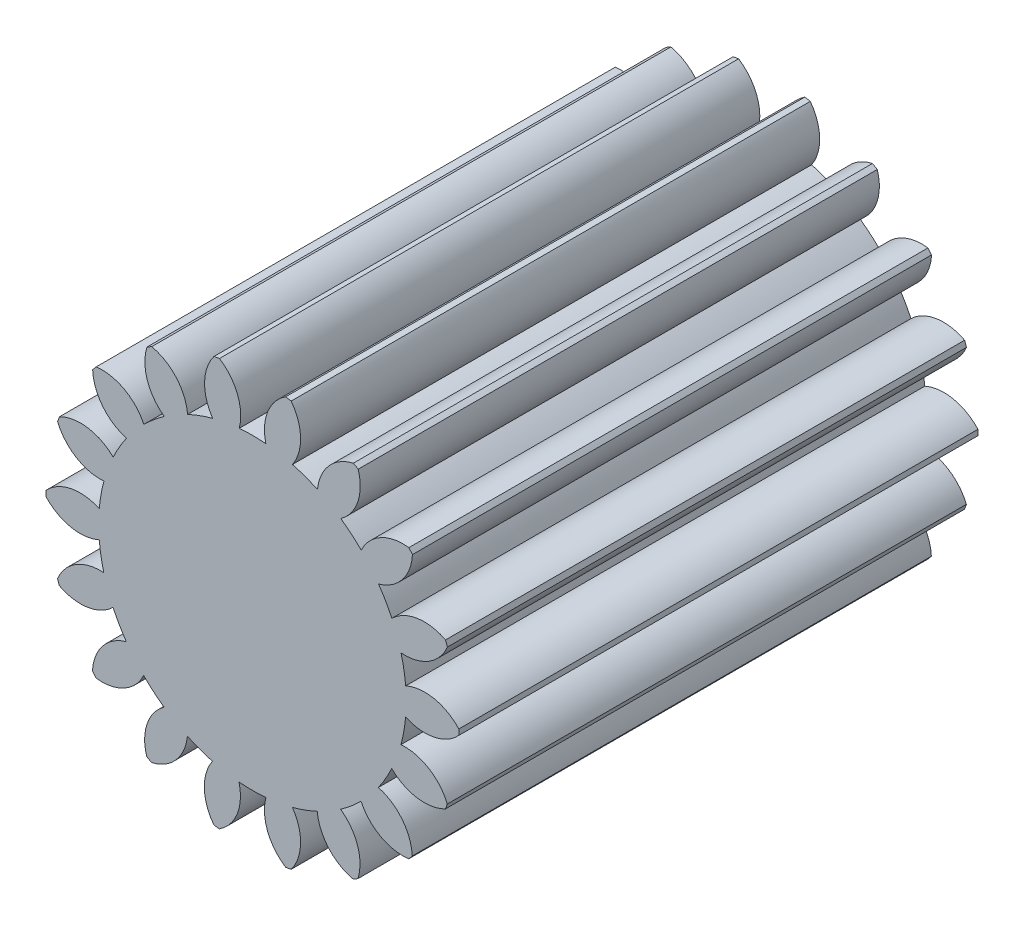
from build123d import *

# Parameters (mm, degrees)
BOSS_EXTRUDE1_DEPTH = 50


with BuildPart() as part:
    # Sketch4 → Boss-Extrude1 (new body)
    with BuildSketch(Plane.XY):
        with BuildLine():
            ThreePointArc((4.968986099, 0.120803098), (5.101132242, 0.098182628), (5.233497909, 0.076884301))
            ThreePointArc((5.233497909, 0.076884301), (6.972697635, 2.203383358), (7.139946857, 4.945433981))
            ThreePointArc((7.139946857, 4.945433981), (8.434999235, 4.888713692), (9.730051613, 4.945433981))
            ThreePointArc((9.730051613, 4.945433981), (9.897300835, 2.203383358), (11.636500561, 0.076884301))
            ThreePointArc((11.636500561, 0.076884301), (11.768866228, 0.098182628), (11.901012371, 0.120803098))
            ThreePointArc((11.901012371, 0.120803098), (12.032925783, 0.144743452), (12.16459328, 0.170001296))
            ThreePointArc((12.16459328, 0.170001296), (13.0716304, 2.764324962), (12.289539875, 5.399010148))
            ThreePointArc((12.289539875, 5.399010148), (13.501291083, 5.782037637), (14.675751687, 6.26752022))
            ThreePointArc((14.675751687, 6.26752022), (15.77017858, 3.746516175), (18.132608433, 2.342181169))
            ThreePointArc((18.132608433, 2.342181169), (18.366147116, 2.473919706), (18.597005377, 2.61030087))
            ThreePointArc((18.597005377, 2.61030087), (18.562422416, 5.35722969), (16.927986588, 7.56526806))
            ThreePointArc((16.927986588, 7.56526806), (17.946753802, 8.346079322), (18.894100505, 9.212155005))
            ThreePointArc((18.894100505, 9.212155005), (20.784759544, 7.217502149), (23.485028304, 6.705857505))
            ThreePointArc((23.485028304, 6.705857505), (23.659425648, 6.909526169), (23.829716347, 7.116640718))
            ThreePointArc((23.829716347, 7.116640718), (22.857714006, 9.686081391), (20.566653119, 11.201948778))
            ThreePointArc((20.566653119, 11.201948778), (21.256927973, 12.284110268), (21.850927349, 13.421966851))
            ThreePointArc((21.850927349, 13.421966851), (24.309777153, 12.194249757), (27.022192556, 12.637007368))
            ThreePointArc((27.022192556, 12.637007368), (27.116413667, 12.888040714), (27.205597232, 13.140907576))
            ThreePointArc((27.205597232, 13.140907576), (25.413413337, 15.222947636), (22.742063147, 15.863808061))
            ThreePointArc((22.742063147, 15.863808061), (23.020588306, 17.116795131), (23.189595265, 18.389190318))
            ThreePointArc((23.189595265, 18.389190318), (25.920062258, 18.076489787), (28.317466974, 19.420246552))
            ThreePointArc((28.317466974, 19.420246552), (28.320147397, 19.688366252), (28.317466974, 19.956485953))
            ThreePointArc((28.317466974, 19.956485953), (25.921265354, 21.30000064), (23.191830118, 20.988556878))
            ThreePointArc((23.191830118, 20.988556878), (23.025011337, 22.261240797), (22.748641145, 23.514704949))
            ThreePointArc((22.748641145, 23.514704949), (25.42139071, 24.154737279), (27.21462235, 26.2374163))
            ThreePointArc((27.21462235, 26.2374163), (27.125438785, 26.490283162), (27.031217673, 26.741316508))
            ThreePointArc((27.031217673, 26.741316508), (24.320015606, 27.184258124), (21.861705497, 25.958074888))
            ThreePointArc((21.861705497, 25.958074888), (21.269663582, 27.096951192), (20.581250564, 28.180298033))
            ThreePointArc((20.581250564, 28.180298033), (22.873909658, 29.695865881), (23.84667802, 32.26626533))
            ThreePointArc((23.84667802, 32.26626533), (23.676387321, 32.473379879), (23.501989977, 32.677048544))
            ThreePointArc((23.501989977, 32.677048544), (20.802798446, 32.165991792), (18.912121943, 30.172964878))
            ThreePointArc((18.912121943, 30.172964878), (17.966265888, 31.040668276), (16.948842813, 31.82323019))
            ThreePointArc((16.948842813, 31.82323019), (18.584882913, 34.031533704), (18.619857777, 36.779625474))
            ThreePointArc((18.619857777, 36.779625474), (18.388999516, 36.916006638), (18.155460833, 37.047745174))
            ThreePointArc((18.155460833, 37.047745174), (15.793842173, 35.644331042), (14.698842765, 33.124848909))
            ThreePointArc((14.698842765, 33.124848909), (13.51325677, 33.616721566), (12.289539875, 34.004110035))
            ThreePointArc((12.289539875, 34.004110035), (13.0716304, 36.638795221), (12.16459328, 39.233118887))
            ThreePointArc((12.16459328, 39.233118887), (11.901012371, 39.282317085), (11.636500561, 39.326235881))
            ThreePointArc((11.636500561, 39.326235881), (9.897300835, 37.199736825), (9.730051613, 34.457686202))
            ThreePointArc((9.730051613, 34.457686202), (8.447734845, 34.514401016), (7.16532245, 34.459891274))
            ThreePointArc((7.16532245, 34.459891274), (6.99913174, 37.203176215), (5.259484699, 39.330818054))
            ThreePointArc((5.259484699, 39.330818054), (4.994972889, 39.286899257), (4.73139198, 39.237701059))
            ThreePointArc((4.73139198, 39.237701059), (3.824384344, 36.644604248), (4.605058031, 34.010716908))
            ThreePointArc((4.605058031, 34.010716908), (3.380676818, 33.625433236), (2.194246783, 33.135599963))
            ThreePointArc((2.194246783, 33.135599963), (1.09981989, 35.656604008), (-1.262609963, 37.060939014))
            ThreePointArc((-1.262609963, 37.060939014), (-1.496148646, 36.929200477), (-1.727006907, 36.792819313))
            ThreePointArc((-1.727006907, 36.792819313), (-1.692423946, 34.045890493), (-0.057988118, 31.837852122))
            ThreePointArc((-0.057988118, 31.837852122), (-1.076755332, 31.05704086), (-2.024102035, 30.190965178))
            ThreePointArc((-2.024102035, 30.190965178), (-3.914761075, 32.185618033), (-6.615029835, 32.697262678))
            ThreePointArc((-6.615029835, 32.697262678), (-6.789427179, 32.493594014), (-6.959717877, 32.286479465))
            ThreePointArc((-6.959717877, 32.286479465), (-5.987715536, 29.717038792), (-3.696654649, 28.201171405))
            ThreePointArc((-3.696654649, 28.201171405), (-4.386929503, 27.119009915), (-4.980928879, 25.981153332))
            ThreePointArc((-4.980928879, 25.981153332), (-7.439778683, 27.208870426), (-10.152194086, 26.766112815))
            ThreePointArc((-10.152194086, 26.766112815), (-10.246415197, 26.515079469), (-10.335598762, 26.262212607))
            ThreePointArc((-10.335598762, 26.262212607), (-8.543414868, 24.180172547), (-5.872064677, 23.539312122))
            ThreePointArc((-5.872064677, 23.539312122), (-6.150589836, 22.286325051), (-6.319596795, 21.013929865))
            ThreePointArc((-6.319596795, 21.013929865), (-9.050063788, 21.326630396), (-11.447468504, 19.982873631))
            ThreePointArc((-11.447468504, 19.982873631), (-11.450148927, 19.714753931), (-11.447468504, 19.44663423))
            ThreePointArc((-11.447468504, 19.44663423), (-9.051266884, 18.103119543), (-6.321831648, 18.414563305))
            ThreePointArc((-6.321831648, 18.414563305), (-6.155012867, 17.141879386), (-5.878642675, 15.888415234))
            ThreePointArc((-5.878642675, 15.888415234), (-8.55139224, 15.248382904), (-10.34462388, 13.165703883))
            ThreePointArc((-10.34462388, 13.165703883), (-10.255440315, 12.91283702), (-10.161219203, 12.661803675))
            ThreePointArc((-10.161219203, 12.661803675), (-7.450017136, 12.218862059), (-4.991707027, 13.445045295))
            ThreePointArc((-4.991707027, 13.445045295), (-4.399665112, 12.306168991), (-3.711252094, 11.222822149))
            ThreePointArc((-3.711252094, 11.222822149), (-6.003911188, 9.707254302), (-6.97667955, 7.136854852))
            ThreePointArc((-6.97667955, 7.136854852), (-6.806388851, 6.929740303), (-6.631991507, 6.726071639))
            ThreePointArc((-6.631991507, 6.726071639), (-3.932799977, 7.23712839), (-2.042123473, 9.230155305))
            ThreePointArc((-2.042123473, 9.230155305), (-1.096267418, 8.362451907), (-0.078844343, 7.579889993))
            ThreePointArc((-0.078844343, 7.579889993), (-1.714884443, 5.371586479), (-1.749859307, 2.623494709))
            ThreePointArc((-1.749859307, 2.623494709), (-1.519001046, 2.487113545), (-1.285462363, 2.355375008))
            ThreePointArc((-1.285462363, 2.355375008), (1.076156297, 3.758789141), (2.171155705, 6.278271274))
            ThreePointArc((2.171155705, 6.278271274), (3.3567417, 5.786398617), (4.580458595, 5.399010148))
            ThreePointArc((4.580458595, 5.399010148), (3.79836807, 2.764324962), (4.705405189, 0.170001296))
            ThreePointArc((4.705405189, 0.170001296), (4.837072687, 0.144743452), (4.968986099, 0.120803098))
        make_face()
    extrude(amount=BOSS_EXTRUDE1_DEPTH)


solid = part.part
